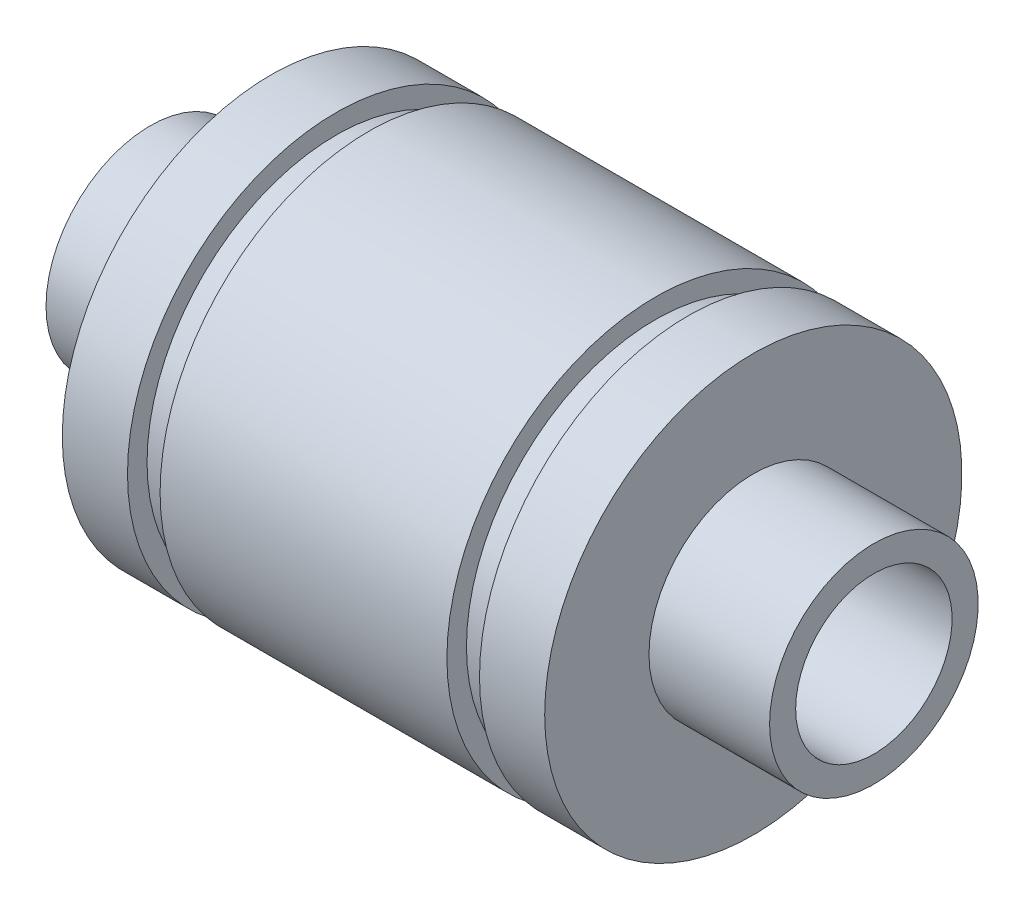
from build123d import *

# Parameters (mm, degrees)
CROQUIS3_R            = 6
CORTAR_EXTRUIR1_DEPTH = 60.935381871


with BuildPart() as part:
    # Croquis2 → Revolución1 (revolve)
    with BuildSketch(Plane.XY, mode=Mode.PRIVATE) as revoluci_n1_sk:
        Polygon((0, 0), (18.5, 0), (27.75, 0), (27.75, 8), (18.5, 8), (18.5, 16), (13.5, 16), (13.5, 14.5), (11, 14.5), (11, 16), (-11, 16), (-11, 14.5), (-13.5, 14.5), (-13.5, 16), (-18.5, 16), (-18.5, 8), (-27.75, 8), (-27.75, 0), (-12.75, 0), align=None)
    revolve(revoluci_n1_sk.sketch.rotate(Axis((-12.75, 0, 0), (1, 0, 0)), 90), axis=Axis((-12.75, 0, 0), (1, 0, 0)))

    # Croquis3 → Cortar-Extruir1 (cut, through all)
    with BuildSketch(Plane.ZY.offset(27.75)):
        Circle(CROQUIS3_R)
    extrude(amount=-CORTAR_EXTRUIR1_DEPTH, mode=Mode.SUBTRACT)


solid = part.part
